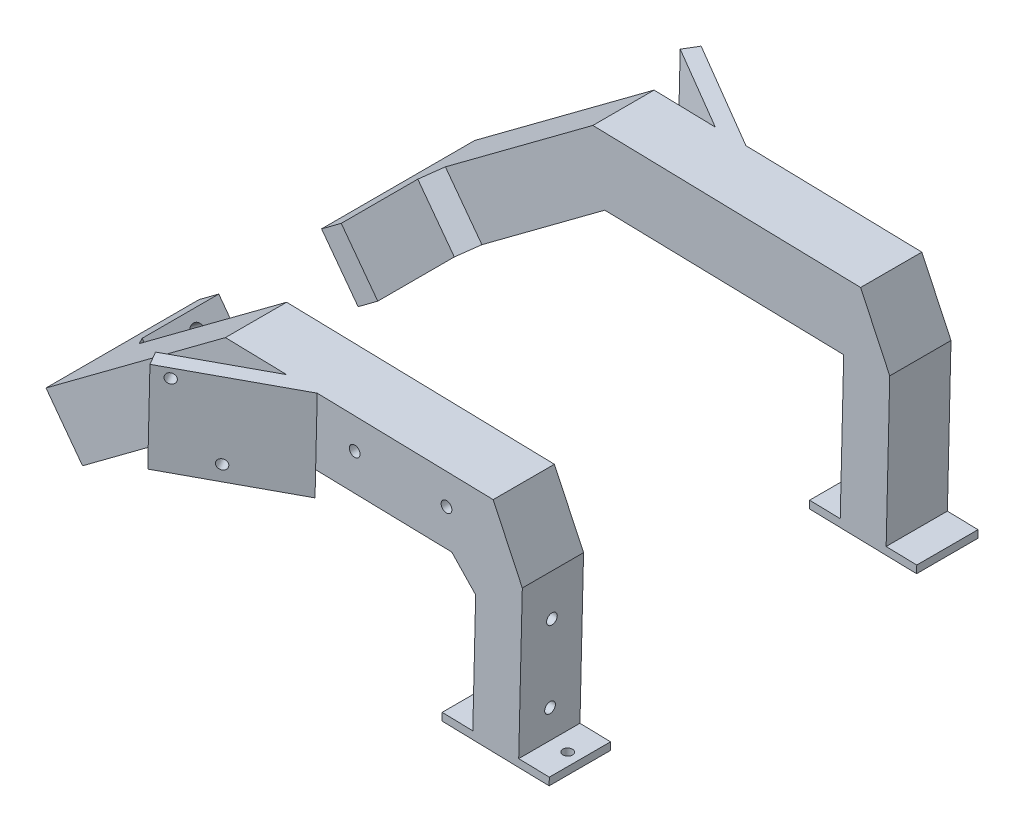
from build123d import *

# Parameters (mm, degrees)
EXTRUDE_1_DEPTH     = 20
EXTRUDE_2_DEPTH     = 30
EXTRUDE_3_DEPTH     = 20
SKETCH_4_W          = 15
SKETCH_4_H          = 20
EXTRUDE_4_DEPTH     = 49.447425698
EXTRUDE_5_DEPTH     = 20
CUT_EXTRUDE_1_DEPTH = 30
EXTRUDE_6_DEPTH     = 30
EXTRUDE_7_DEPTH     = 20
SKETCH_9_R          = 1.6
CUT_EXTRUDE_2_DEPTH = 10
SKETCH_10_R         = 2.1
CUT_EXTRUDE_3_DEPTH = 10
SKETCH_11_R         = 1.75
CUT_EXTRUDE_4_DEPTH = 202.855572154
SKETCH_12_R         = 1.6
CUT_EXTRUDE_5_DEPTH = 10
SKETCH_13_R         = 1.75
CUT_EXTRUDE_7_DEPTH = 20


with BuildPart() as part:
    # 草图1 → 凸台-拉伸1 (new body)
    with BuildSketch(Plane.XY):
        Polygon((-24.728355126, 34.093691019), (-83.319008043, -9.450945744), (-71.388970574, -25.50317942), (-20.824434495, 12.076438608), (72.190663405, 9.835314871), (72.718578523, 31.745785774), align=None)
    extrude(amount=EXTRUDE_1_DEPTH)

    # 草图2 → 凸台-拉伸2 (add)
    with BuildSketch(Plane(origin=(0, 0, 0), x_dir=(-1, 0, 0), z_dir=(0, 0, -1))):
        Polygon((71.388970574, -25.50317942), (83.319008043, -9.450945744), (76.898114573, -4.678930756), (64.968077103, -20.731164432), align=None)
    extrude(amount=EXTRUDE_2_DEPTH)

    # 草图3 → 凸台-拉伸3 (add)
    with BuildSketch(Plane(origin=(-25.121381082, 33.801593702, 0), x_dir=(0.8026116837907572, 0.5965018734610694, 0), z_dir=(-0.5965018734610694, 0.8026116837907572, 0))):
        Polygon((-64.510316179, 5), (-59.510316179, 0), (-64.510316179, 0), align=None)
    extrude(amount=-EXTRUDE_3_DEPTH)

    # 草图4 → 凸台-拉伸4 (add)
    with BuildSketch(Plane(origin=(0.278721027, 11.567975102, 0), x_dir=(0.9997098612470757, -0.024087202522351275, 0), z_dir=(-0.024087202522351272, -0.9997098612470756, 0))):
        with Locations((64.432812874, 10)):
            Rectangle(SKETCH_4_W, SKETCH_4_H)
    extrude(amount=EXTRUDE_4_DEPTH)

    # 草图5 → 凸台-拉伸5 (add)
    with BuildSketch(Plane.XY.offset(20)):
        Polygon((46.006866716, -38.99558415), (46.067084723, -36.496309497), (81.056929866, -37.339361585), (80.99671186, -39.838636238), align=None)
    extrude(amount=-EXTRUDE_5_DEPTH)

    # 草图6 → 切除-拉伸1 (cut)
    with BuildSketch(Plane.XY.offset(20)):
        Polygon((62.718578523, 31.986727706), (72.23669466, 11.745785774), (72.718578523, 31.745785774), align=None)
    extrude(amount=-CUT_EXTRUDE_1_DEPTH, mode=Mode.SUBTRACT)

    # 草图7 → 凸台-拉伸6 (add)
    with BuildSketch(Plane(origin=(0.806636145, 33.478446006, 0), x_dir=(0.9997098612470757, -0.02408720252235126, 0), z_dir=(0.024087202522351258, 0.9997098612470756, 0))):
        Polygon((-5.542402112, -20), (-32.683418264, -35.669872981), (-30.183418264, -40), (4.457597888, -20), align=None)
    extrude(amount=-EXTRUDE_6_DEPTH)


with BuildPart() as body_2:
    # 镜向4: mirrored copy
    add(part.part.mirror(Plane(origin=(0, 0, -50), x_dir=(1, 0, 0), z_dir=(0, 0, -1))))


with BuildPart() as part_1:
    add(part.part)

    # 草图8 → 凸台-拉伸7 (add)
    with BuildSketch(Plane.XY.offset(20)):
        Polygon((49.195015486, 10.389376454), (57.00226194, 2.196622908), (57.195015486, 10.196622908), align=None)
    extrude(amount=-EXTRUDE_7_DEPTH)

    # 草图9 → 切除-拉伸2 (cut)
    with BuildSketch(Plane(origin=(-0.852111124, -35.365829328, 0), x_dir=(0.9997098612470757, -0.02408720252235112, 0), z_dir=(0.024087202522351116, 0.9997098612470756, 0))):
        with Locations(Location((77.932812874, -10, 0), (0, 0, 180))):
            Circle(SKETCH_9_R)
        with Locations(Location((50.932812874, -10, 0), (0, 0, 180))):
            Circle(SKETCH_9_R)
    extrude(amount=-CUT_EXTRUDE_2_DEPTH, mode=Mode.SUBTRACT)

    # 草图10 → 切除-拉伸3 (cut)
    with BuildSketch(Plane(origin=(-51.776733491, -38.480524459, 0), x_dir=(0, 0, -1), z_dir=(0.8026116837907572, 0.5965018734610693, 0))):
        with Locations(Location((20, 37.114504915, 0), (0, 0, 90))):
            Circle(SKETCH_10_R)
        with Locations(Location((20, 27.114504915, 0), (0, 0, 90))):
            Circle(SKETCH_10_R)
    extrude(amount=-CUT_EXTRUDE_3_DEPTH, mode=Mode.SUBTRACT)

    # 草图11 → 切除-拉伸4 (cut, through all)
    with BuildSketch(Plane(origin=(56.916294459, -1.371352194, 0), x_dir=(0, 0, 1), z_dir=(-0.9997098612470756, 0.024087202522351286, 0))):
        with Locations(Location((10, -0.430989389, 0), (0, 0, 270))):
            Circle(SKETCH_11_R)
        with Locations(Location((10, -25.830989389, 0), (0, 0, 270))):
            Circle(SKETCH_11_R)
    extrude(amount=-CUT_EXTRUDE_4_DEPTH, mode=Mode.SUBTRACT)

    # 草图12 → 切除-拉伸5 (cut)
    with BuildSketch(Plane(origin=(9.771817504, -0.235444059, 16.930196505), x_dir=(0.8661091434290129, 0.006950686894989351, -0.4998066022176473), z_dir=(0.4998549306235377, -0.012043601261175624, 0.8660254037844388))):
        with Locations(Location((-40.275793685, 31.620495598, 0), (0, 0, 359.601722883))):
            Circle(SKETCH_12_R)
        with Locations(Location((-28.192461779, 9.278761331, 0), (0, 0, 359.601722883))):
            Circle(SKETCH_12_R)
    extrude(amount=-CUT_EXTRUDE_5_DEPTH, mode=Mode.SUBTRACT)

    # 草图13 → 切除-拉伸7 (cut)
    with BuildSketch(Plane(origin=(0, 0, 0), x_dir=(-1, 0, 0), z_dir=(0, 0, -1))):
        with Locations((-47.484959967, 22.350867225)):
            Circle(SKETCH_13_R)
        with Locations((-17.493664129, 23.0734833)):
            Circle(SKETCH_13_R)
    extrude(amount=-CUT_EXTRUDE_7_DEPTH, mode=Mode.SUBTRACT)


solid = Compound([body_2.part, part_1.part])
